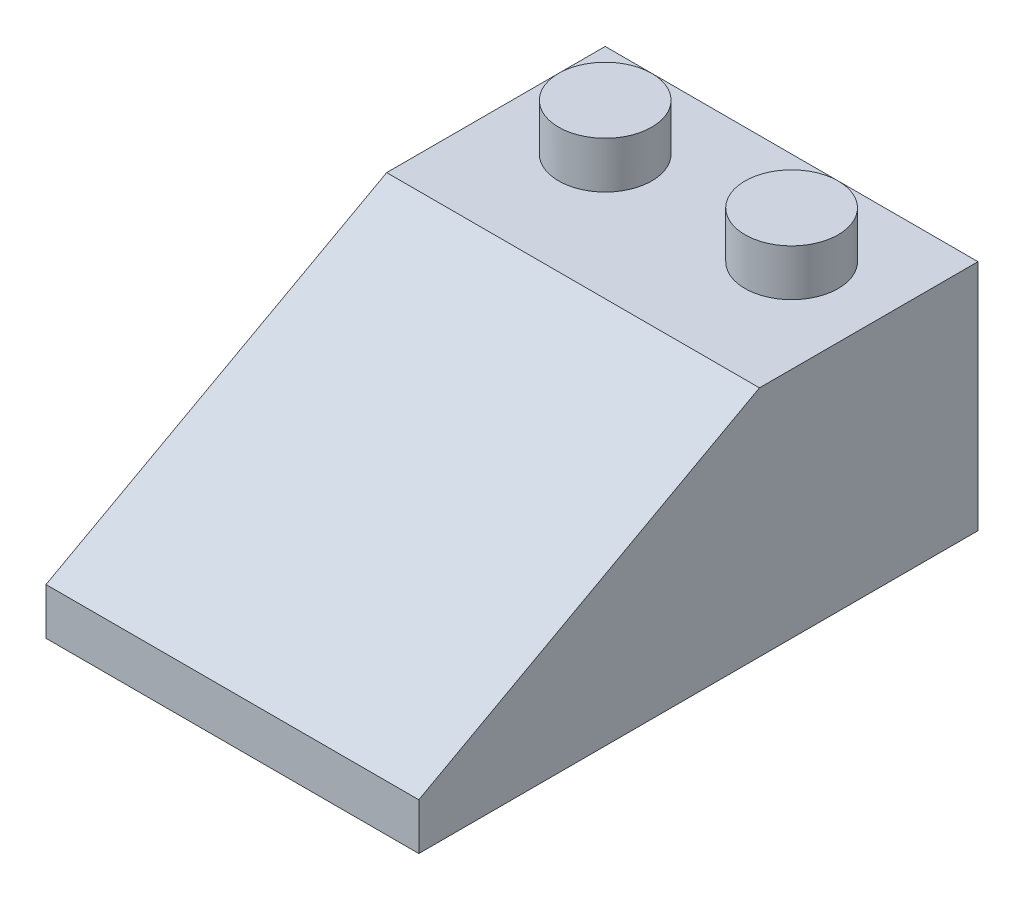
from build123d import *

# Parameters (mm, degrees)
BOSS_EXTRUDE1_DEPTH = 16
SKETCH2_R           = 2
BOSS_EXTRUDE2_DEPTH = 2
SHELL1_T            = -1
BOSS_EXTRUDE3_REACH = 33.241
SKETCH3_R           = 2.7
SKETCH3_R_2         = 1.7


with BuildPart() as part:
    # Sketch1 → Boss-Extrude1 (new body)
    with BuildSketch(Plane(origin=(0, 0, 0), x_dir=(0, 0, -1), z_dir=(1, 0, 0))):
        Polygon((0, 0), (24, 0), (24, 10), (14.620689655, 10), (0, 2), align=None)
    extrude(amount=BOSS_EXTRUDE1_DEPTH)

    # Sketch2 → Boss-Extrude2 (add)
    with BuildSketch(Plane(origin=(0, 10, 0), x_dir=(1, 0, 0), z_dir=(0, 1, 0))):
        with Locations(Location((4, 20, 0), (0, 0, 90))):
            Circle(SKETCH2_R)
        with Locations(Location((12, 20, 0), (0, 0, 90))):
            Circle(SKETCH2_R)
    extrude(amount=BOSS_EXTRUDE2_DEPTH)

    # Shell1
    shell1_openings = [part.faces().sort_by_distance(p)[0] for p in [
        (8, 0, -12),
    ]]
    offset(amount=SHELL1_T, openings=shell1_openings, kind=Kind.INTERSECTION)

    # Sketch3 → Boss-Extrude3 (add, up to next)
    with BuildSketch(Plane.XZ, mode=Mode.PRIVATE) as boss_extrude3_sk1:
        with Locations(Location((8, -8, 0), (0, 0, 270))):
            Circle(SKETCH3_R)
        with Locations(Location((8, -8, 0), (0, 0, 270))):
            Circle(SKETCH3_R_2, mode=Mode.SUBTRACT)
    boss_extrude3_tool1 = extrude(boss_extrude3_sk1.sketch, amount=-BOSS_EXTRUDE3_REACH, mode=Mode.PRIVATE) - part.part
    # Sketch3 → Boss-Extrude3 (add, up to next)
    with BuildSketch(Plane.XZ, mode=Mode.PRIVATE) as boss_extrude3_sk2:
        with Locations(Location((8, -16, 0), (0, 0, 24.591939532))):
            Circle(SKETCH3_R)
        with Locations(Location((8, -16, 0), (0, 0, 41.372265033))):
            Circle(SKETCH3_R_2, mode=Mode.SUBTRACT)
    boss_extrude3_tool2 = extrude(boss_extrude3_sk2.sketch, amount=-BOSS_EXTRUDE3_REACH, mode=Mode.PRIVATE) - part.part
    add(boss_extrude3_tool1.solids().sort_by_distance((8, 0, -5.376368))[0])
    add(boss_extrude3_tool2.solids().sort_by_distance((5.614345, 0, -17.091832))[0])


solid = part.part
